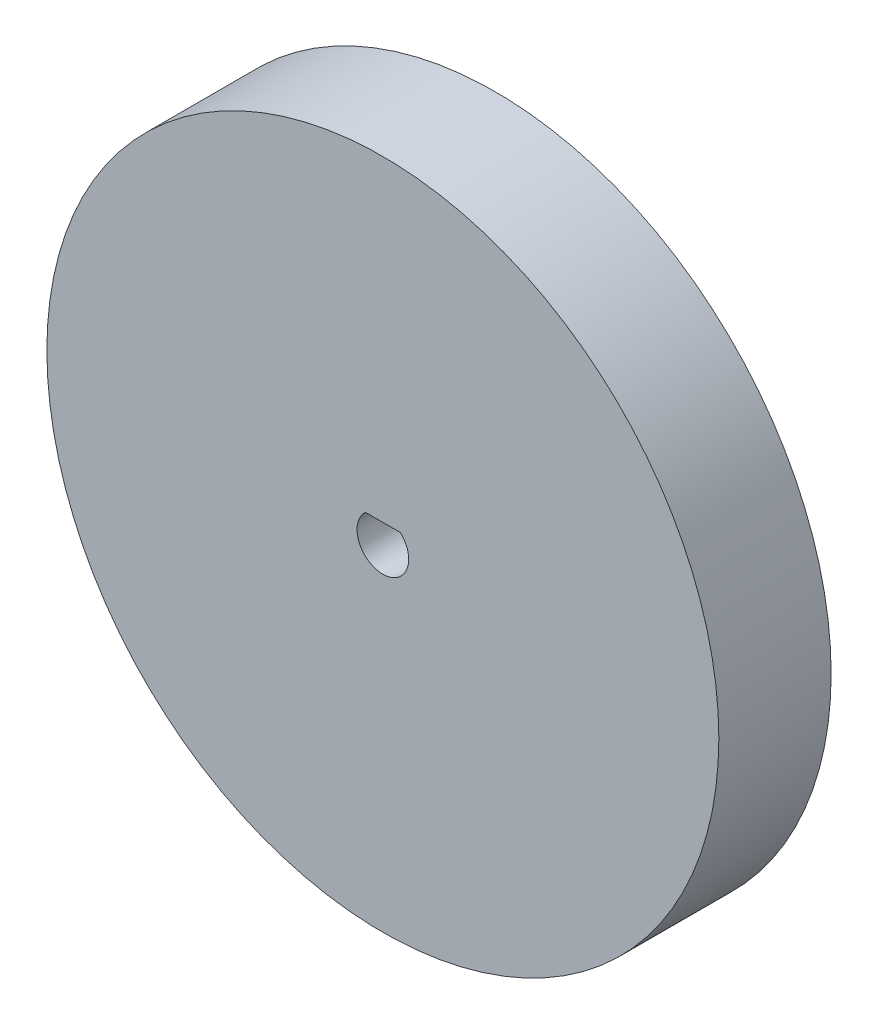
from build123d import *

# Parameters (mm, degrees)
SKETCH1_R           = 37.999999946
BOSS_EXTRUDE1_DEPTH = 12.7
CUT_EXTRUDE1_DEPTH  = 56.2203766


with BuildPart() as part:
    # Sketch1 → Boss-Extrude1 (new body)
    with BuildSketch(Plane.XY):
        Circle(SKETCH1_R)
    extrude(amount=BOSS_EXTRUDE1_DEPTH)

    # Sketch2 → Cut-Extrude1 (cut, through all)
    with BuildSketch(Plane.XY.offset(12.7)):
        with BuildLine():
            Line((1.96747554, 2.159), (-1.96747554, 2.159))
            ThreePointArc((-1.96747554, 2.159), (0, -2.921), (1.96747554, 2.159))
        make_face()
    extrude(amount=-CUT_EXTRUDE1_DEPTH, mode=Mode.SUBTRACT)


solid = part.part
